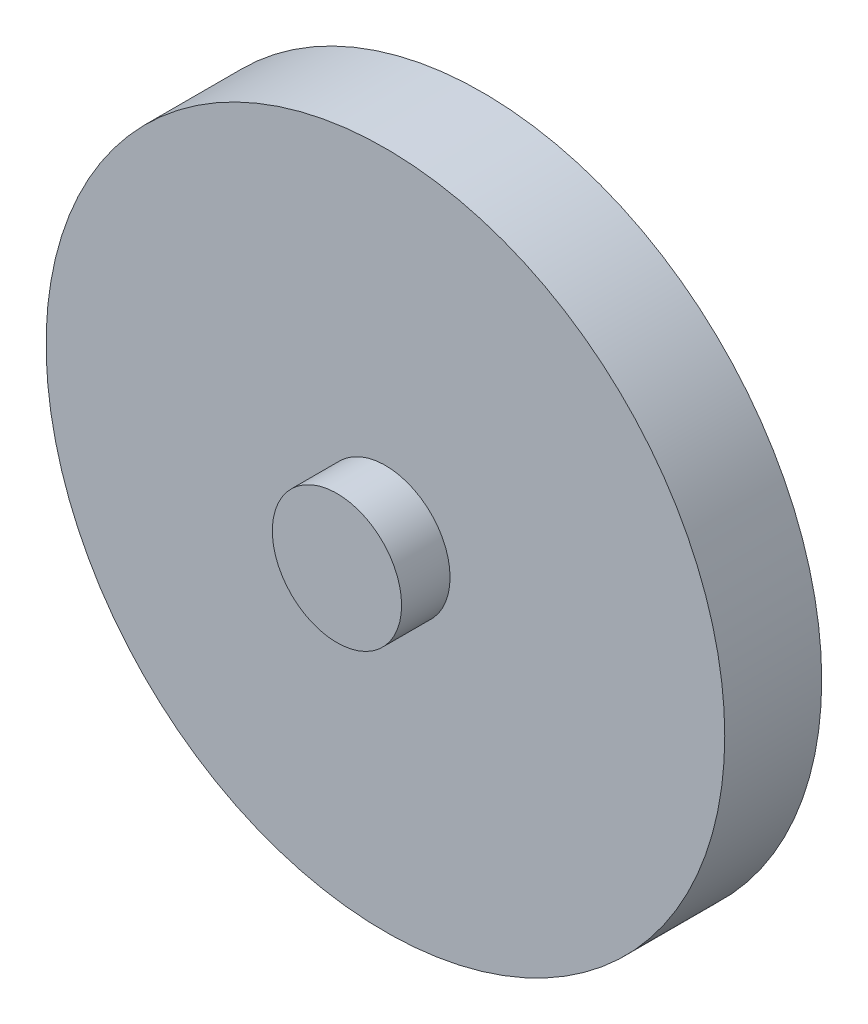
from build123d import *

# Parameters (mm, degrees)
SKETCH_1_R      = 8
EXTRUDE_1_DEPTH = 6
SKETCH_2_R      = 42
EXTRUDE_2_DEPTH = 12
SKETCH_3_R      = 8
EXTRUDE_3_DEPTH = 6


with BuildPart() as part:
    # 草图1 → 凸台-拉伸1 (new body)
    with BuildSketch(Plane.XY):
        Circle(SKETCH_1_R)
    extrude(amount=EXTRUDE_1_DEPTH)

    # 草图2 → 凸台-拉伸2 (add)
    with BuildSketch(Plane.XY.offset(6)):
        Circle(SKETCH_2_R)
    extrude(amount=EXTRUDE_2_DEPTH)

    # 草图3 → 凸台-拉伸3 (add)
    with BuildSketch(Plane.XY.offset(18)):
        Circle(SKETCH_3_R)
    extrude(amount=EXTRUDE_3_DEPTH)


solid = part.part
